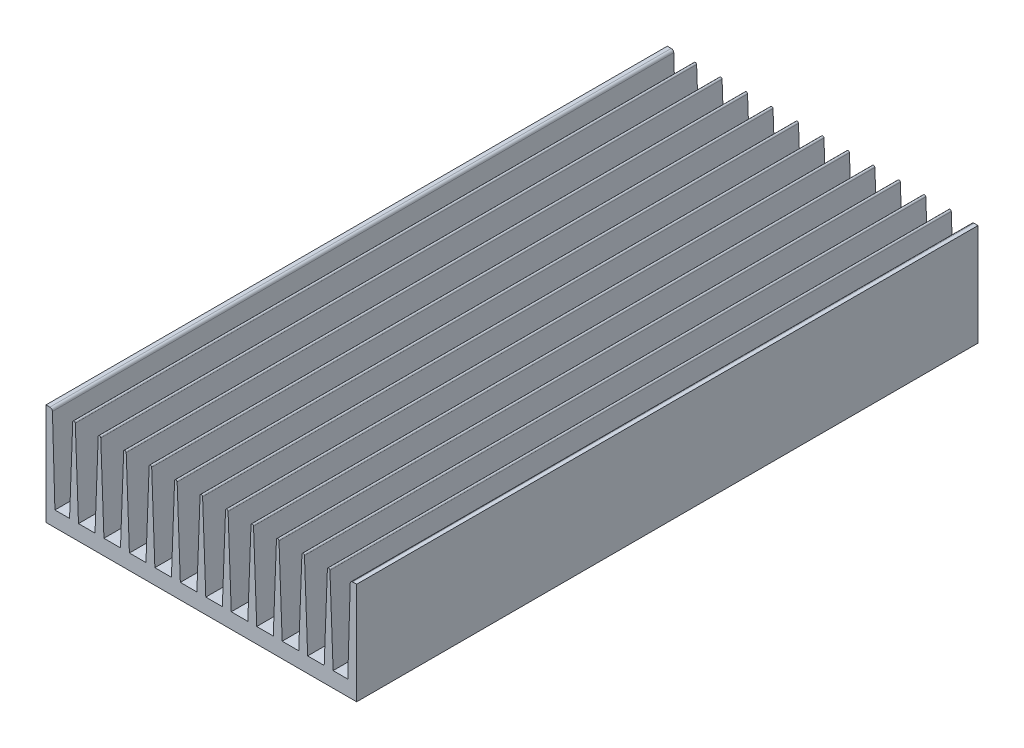
from build123d import *

# Parameters (mm, degrees)
EXTRUDE_1_DEPTH       = 244
EXTRUDE_3_DEPTH       = 244
PATTERN_CURVE_1_COUNT = 11
PATTERN_CURVE_1_PITCH = 10
SKETCH_3_R            = 2.25
CUT_EXTRUDE_1_DEPTH   = 6
SKETCH_4_R            = 2.6
SKETCH_4_R_2          = 1.6
CUT_EXTRUDE_2_DEPTH   = 6
SKETCH_5_R            = 2.1
SKETCH_5_R_2          = 1.6
CUT_EXTRUDE_3_DEPTH   = 6


with BuildPart() as part:
    # Эскиз1 → Вытянуть1 (new body)
    with BuildSketch(Plane.XY):
        with BuildLine():
            Line((0, 40), (1.528979332, 40))
            ThreePointArc((1.528979332, 40), (2.225614441, 39.717425624), (2.528547087, 39.029399052))
            Line((2.528547087, 39.029399052), (3.5, 6))
            Line((3.5, 6), (118.5, 6))
            Line((118.5, 6), (119.471452913, 39.029399052))
            ThreePointArc((119.471452913, 39.029399052), (119.774385559, 39.717425624), (120.471020668, 40))
            Line((120.471020668, 40), (122, 40))
            Line((122, 40), (122, 0))
            Line((122, 0), (0, 0))
            Line((0, 0), (0, 40))
        make_face()
    extrude(amount=EXTRUDE_1_DEPTH)

    # Эскиз2 → Вытянуть3 (add)
    with BuildSketch(Plane.XY.offset(244)):
        with BuildLine():
            Line((10.5, 39.5), (9.25, 6))
            Line((9.25, 6), (12.75, 6))
            Line((12.75, 6), (11.5, 39.5))
            ThreePointArc((11.5, 39.5), (11, 40), (10.5, 39.5))
        make_face()
    extrude_3 = extrude(amount=-EXTRUDE_3_DEPTH)

    # Кривая1: Вытянуть3 ×11
    with Locations(*[(i * PATTERN_CURVE_1_PITCH, 0, 0) for i in range(1, PATTERN_CURVE_1_COUNT)]):
        add(extrude_3)

    # Эскиз3 → Вырез-Вытянуть1 (cut)
    with BuildSketch(Plane.XZ):
        with Locations((26, 236)):
            Circle(SKETCH_3_R)
        with Locations((96, 236)):
            Circle(SKETCH_3_R)
        with Locations(Location((96, 8, 0), (0, 0, 180))):
            Circle(SKETCH_3_R)
        with Locations(Location((26, 8, 0), (0, 0, 180))):
            Circle(SKETCH_3_R)
    extrude(amount=-CUT_EXTRUDE_1_DEPTH, mode=Mode.SUBTRACT)

    # Эскиз4 → Вырез-Вытянуть2 (cut)
    with BuildSketch(Plane(origin=(-5.723570629, 0, -26.359021189), x_dir=(1, 0, 0), z_dir=(0, -1, 0))):
        with Locations((94.223570629, 89.359021189)):
            Circle(SKETCH_4_R)
        with Locations((67.723570629, 187.359021189)):
            Circle(SKETCH_4_R_2)
        with Locations((67.723570629, 52.359021189)):
            Circle(SKETCH_4_R_2)
        with Locations((107.973570629, 183.759021189)):
            Circle(SKETCH_4_R_2)
        with Locations((107.973570629, 99.959021189)):
            Circle(SKETCH_4_R_2)
    extrude(amount=-CUT_EXTRUDE_2_DEPTH, mode=Mode.SUBTRACT)

    # Эскиз5 → Вырез-Вытянуть3 (cut)
    with BuildSketch(Plane(origin=(128.324191418, 0, 423.775874855), x_dir=(-1, 0, 0), z_dir=(0, -1, 0))):
        with Locations(Location((89.324191418, 279.775874855, 0), (0, 0, 180))):
            Circle(SKETCH_5_R)
        with Locations((21.324191418, 239.775874855)):
            Circle(SKETCH_5_R_2)
        with Locations((81.324191418, 239.775874855)):
            Circle(SKETCH_5_R_2)
        with Locations(Location((81.324191418, 204.775874855, 0), (0, 0, 180))):
            Circle(SKETCH_5_R_2)
        with Locations(Location((21.324191418, 204.775874855, 0), (0, 0, 180))):
            Circle(SKETCH_5_R_2)
    extrude(amount=-CUT_EXTRUDE_3_DEPTH, mode=Mode.SUBTRACT)


solid = part.part
